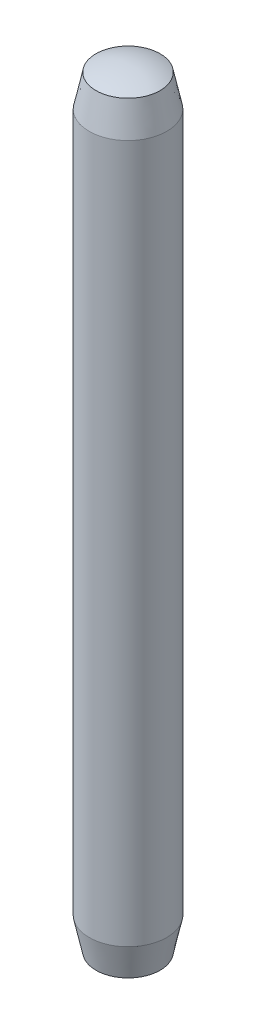
from build123d import *

# Parameters (mm, degrees)
SKETCH1_R           = 0.5
BOSS_EXTRUDE1_DEPTH = 10


with BuildPart() as part:
    # Sketch1 → Boss-Extrude1 (new body)
    with BuildSketch(Plane(origin=(0, 0, 0), x_dir=(1, 0, 0), z_dir=(0, 1, 0))):
        with Locations(Location((0, 0, 0), (0, 0, 270))):
            Circle(SKETCH1_R)
    extrude(amount=BOSS_EXTRUDE1_DEPTH)

    # Sketch2 → Cut-Revolve2 (revolve, cut)
    with BuildSketch(Plane.XY):
        with BuildLine():
            Line((0.5, 9.866025404), (0.5, 10.1))
            Line((0.5, 10.1), (0, 10.1))
            Line((0, 10.1), (0, 10))
            ThreePointArc((0, 10), (0.258819045, 9.965925826), (0.5, 9.866025404))
        make_face()
        with BuildLine():
            Line((0.5, -0.1), (0, -0.1))
            Line((0, -0.1), (0, 0))
            ThreePointArc((0, 0), (0.258819045, 0.034074174), (0.5, 0.133974596))
            Line((0.5, 0.133974596), (0.5, -0.1))
        make_face()
    revolve(axis=Axis((0, 0, 0), (0, 1, 0)), mode=Mode.SUBTRACT)

    # Sketch3 → Cut-Revolve3 (revolve, cut)
    with BuildSketch(Plane.XY, mode=Mode.PRIVATE) as cut_revolve3_sk:
        with BuildLine():
            Line((-0.5, 9.5), (-0.41266406, 9.910883293))
            ThreePointArc((-0.41266406, 9.910883293), (-0.456882894, 9.889526852), (-0.5, 9.866025404))
            Line((-0.5, 9.866025404), (-0.5, 9.5))
        make_face()
        with BuildLine():
            Line((-0.5, 0.133974596), (-0.5, 0.5))
            Line((-0.5, 0.5), (-0.41266406, 0.089116707))
            ThreePointArc((-0.41266406, 0.089116707), (-0.456882894, 0.110473148), (-0.5, 0.133974596))
        make_face()
    revolve(cut_revolve3_sk.sketch.rotate(Axis((0, 0, 0), (0, 1, 0)), 180), axis=Axis((0, 0, 0), (0, 1, 0)), mode=Mode.SUBTRACT)


solid = part.part
